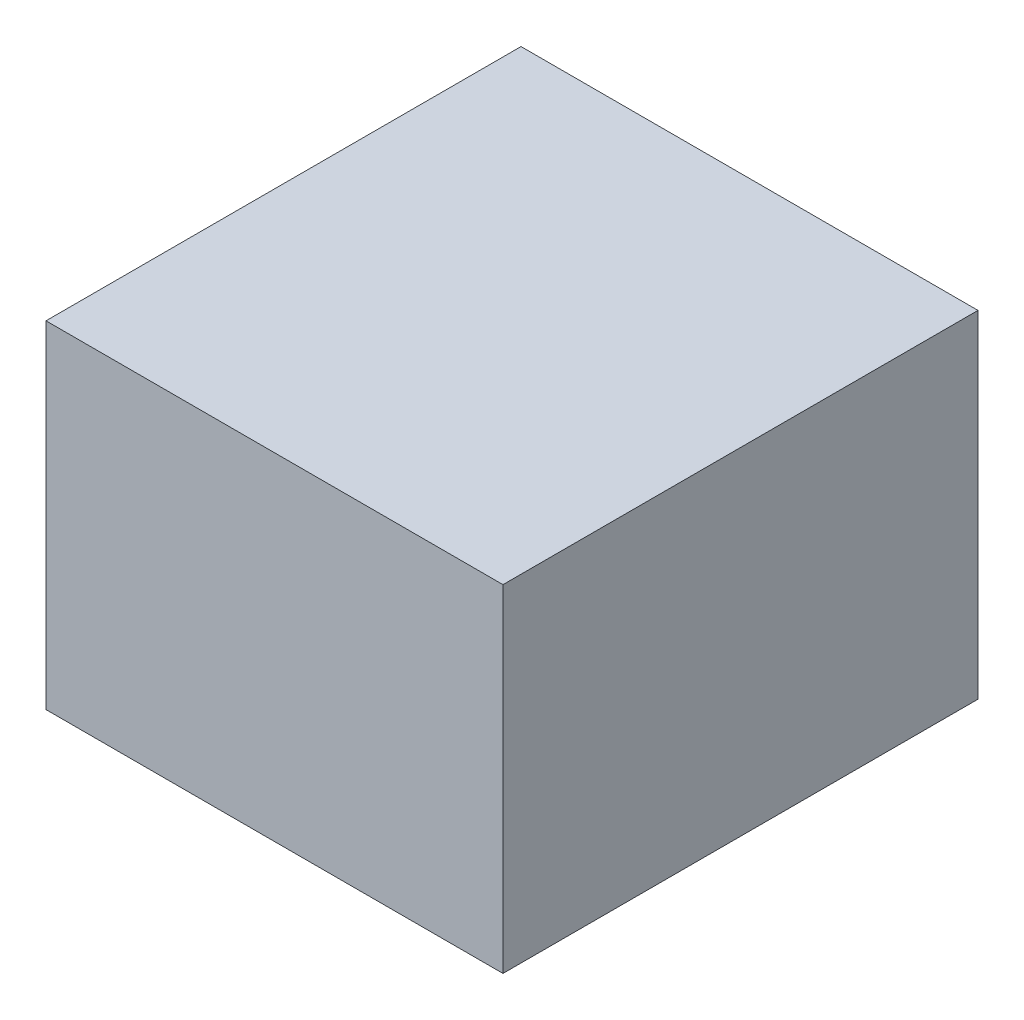
from build123d import *

# Parameters (mm, degrees)
SKETCH1_W           = 7.6
SKETCH1_H           = 7.9
BOSS_EXTRUDE1_DEPTH = 5.6
SKETCH3_W           = 4.7
SKETCH3_H           = 4
CUT_EXTRUDE1_DEPTH  = 4.5


with BuildPart() as part:
    # Sketch1 → Boss-Extrude1 (new body)
    with BuildSketch(Plane(origin=(0, 0, 0), x_dir=(1, 0, 0), z_dir=(0, 1, 0))):
        Rectangle(SKETCH1_W, SKETCH1_H)
    extrude(amount=BOSS_EXTRUDE1_DEPTH)

    # Sketch3 → Cut-Extrude1 (cut)
    with BuildSketch(Plane.ZY.offset(3.8)):
        with Locations((0, 2.8)):
            Rectangle(SKETCH3_W, SKETCH3_H)
    extrude(amount=-CUT_EXTRUDE1_DEPTH, mode=Mode.SUBTRACT)


solid = part.part
